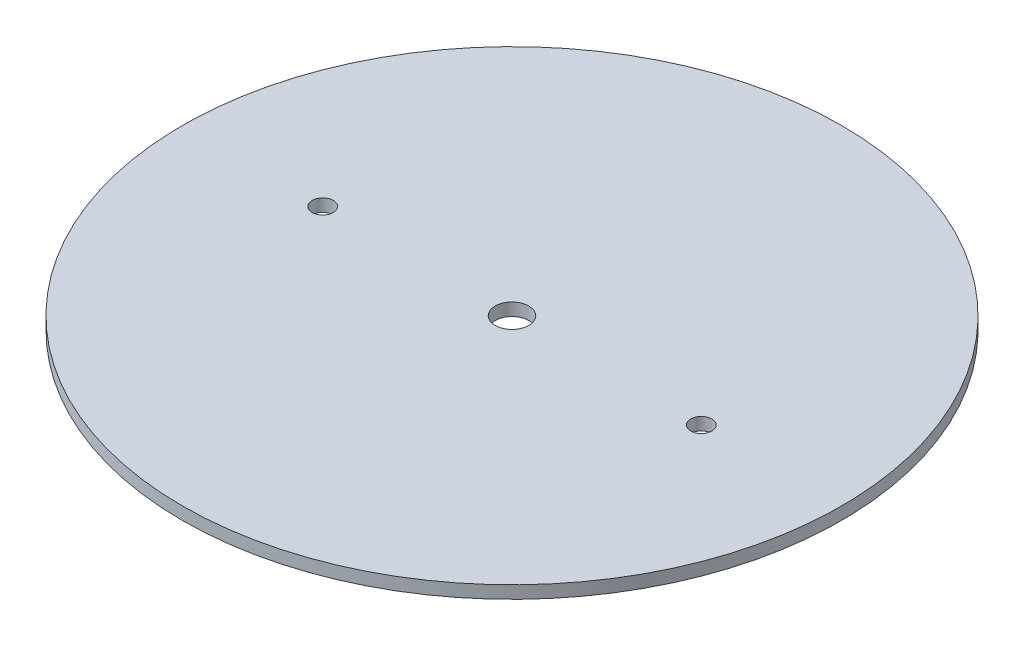
from build123d import *

# Parameters (mm, degrees)
SKETCH1_R           = 78.35
SKETCH1_R_2         = 2.5
SKETCH1_R_3         = 4
BOSS_EXTRUDE1_DEPTH = 3


with BuildPart() as part:
    # Sketch1 → Boss-Extrude1 (new body)
    with BuildSketch(Plane(origin=(0, 0, 0), x_dir=(1, 0, 0), z_dir=(0, 1, 0))):
        with Locations(Location((0, 0, 0), (0, 0, 270))):
            Circle(SKETCH1_R)
        with Locations(Location((-45, 0, 0), (0, 0, 270))):
            Circle(SKETCH1_R_2, mode=Mode.SUBTRACT)
        with Locations(Location((45, 0, 0), (0, 0, 270))):
            Circle(SKETCH1_R_2, mode=Mode.SUBTRACT)
        with Locations(Location((0, 0, 0), (0, 0, 270))):
            Circle(SKETCH1_R_3, mode=Mode.SUBTRACT)
    extrude(amount=BOSS_EXTRUDE1_DEPTH)


solid = part.part
